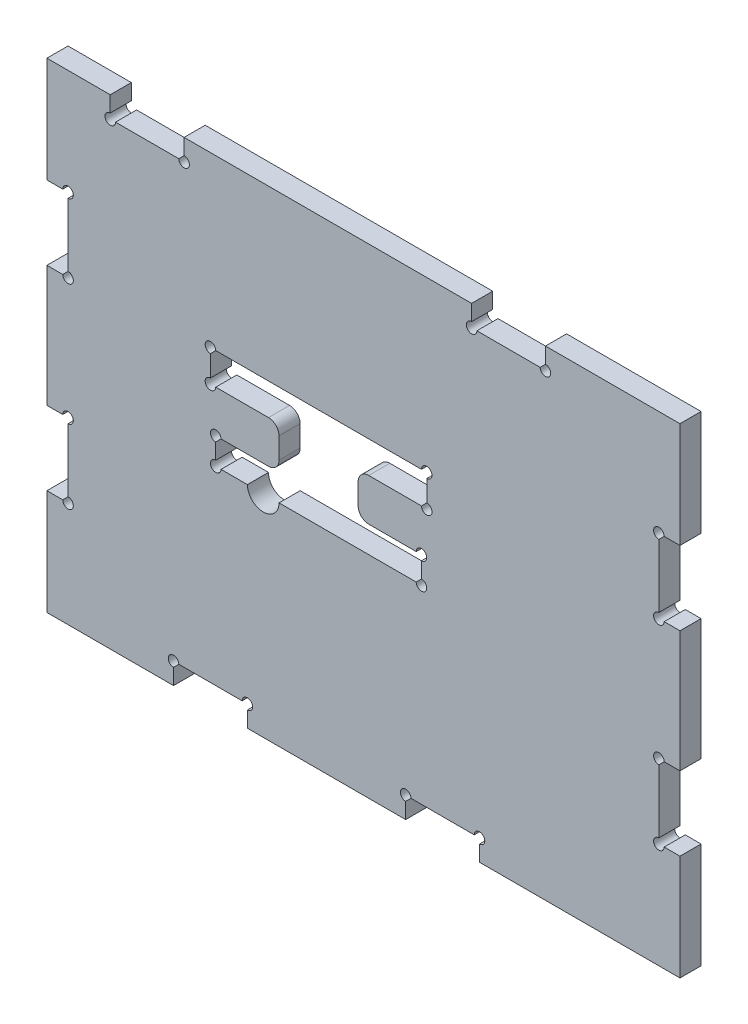
from build123d import *

# Parameters (mm, degrees)
SKETCH_1_W          = 60
SKETCH_1_H          = 45.5
EXTRUDE_1_DEPTH     = 2
SKETCH_2_W          = 7
SKETCH_2_H          = 2
SKETCH_2_W_2        = 2
SKETCH_2_H_2        = 7
CUT_EXTRUDE_1_DEPTH = 76.327617777
SKETCH_4_R          = 0.5
CUT_EXTRUDE_2_DEPTH = 76.327617777
SKETCH_5_W          = 20.5
SKETCH_5_H          = 8
CUT_EXTRUDE_3_DEPTH = 76.327617777
SKETCH_6_W          = 6.5
SKETCH_6_H          = 5
EXTRUDE_2_DEPTH     = 2
SKETCH_7_R          = 0.5
CUT_EXTRUDE_4_DEPTH = 76.327617777
SKETCH_8_W          = 19.5
SKETCH_8_H          = 2.5
CUT_EXTRUDE_5_DEPTH = 76.327617777
FILLET_1_R          = 1
SKETCH_9_R          = 0.5
CUT_EXTRUDE_6_DEPTH = 2
SKETCH_10_R         = 1.5
CUT_EXTRUDE_7_DEPTH = 76.327617777


with BuildPart() as part:
    # 草图1 → 凸台-拉伸1 (new body)
    with BuildSketch(Plane.XY):
        with Locations((30, 22.75)):
            Rectangle(SKETCH_1_W, SKETCH_1_H)
    extrude(amount=EXTRUDE_1_DEPTH)

    # 草图2 → 切除-拉伸1 (cut, through all)
    with BuildSketch(Plane.XY.offset(2)):
        with Locations((9.5, 44.5)):
            Rectangle(SKETCH_2_W, SKETCH_2_H)
        with Locations((43.75, 44.5)):
            Rectangle(SKETCH_2_W, SKETCH_2_H)
        with Locations((15.5, 1)):
            Rectangle(SKETCH_2_W, SKETCH_2_H)
        with Locations((37.5, 1)):
            Rectangle(SKETCH_2_W, SKETCH_2_H)
        with Locations((1, 32)):
            Rectangle(SKETCH_2_W_2, SKETCH_2_H_2)
        with Locations((1, 13.5)):
            Rectangle(SKETCH_2_W_2, SKETCH_2_H_2)
        with Locations((59, 32)):
            Rectangle(SKETCH_2_W_2, SKETCH_2_H_2)
        with Locations((59, 13.5)):
            Rectangle(SKETCH_2_W_2, SKETCH_2_H_2)
    extrude(amount=-CUT_EXTRUDE_1_DEPTH, mode=Mode.SUBTRACT)

    # 草图4 → 切除-拉伸2 (cut, through all)
    with BuildSketch(Plane.XY.offset(2)):
        with Locations((6, 43.5)):
            Circle(SKETCH_4_R)
    cut_extrude_2 = extrude(amount=-CUT_EXTRUDE_2_DEPTH, mode=Mode.SUBTRACT)

    # 草图5 → 切除-拉伸3 (cut, through all)
    with BuildSketch(Plane.XY.offset(2)):
        with Locations((25.75, 25.5)):
            Rectangle(SKETCH_5_W, SKETCH_5_H)
    extrude(amount=-CUT_EXTRUDE_3_DEPTH, mode=Mode.SUBTRACT)

    # 草图6 → 凸台-拉伸2 (add)
    with BuildSketch(Plane.XY.offset(2)):
        with Locations((18.75, 24)):
            Rectangle(SKETCH_6_W, SKETCH_6_H)
        with Locations((32.75, 24)):
            Rectangle(SKETCH_6_W, SKETCH_6_H)
    extrude(amount=-EXTRUDE_2_DEPTH)

    # 草图7 → 切除-拉伸4 (cut, through all)
    with BuildSketch(Plane.XY.offset(2)):
        with Locations((15.5, 29.5)):
            Circle(SKETCH_7_R)
        with Locations((15.5, 26.5)):
            Circle(SKETCH_7_R)
        with Locations((36, 29.5)):
            Circle(SKETCH_7_R)
        with Locations((36, 26.5)):
            Circle(SKETCH_7_R)
    extrude(amount=-CUT_EXTRUDE_4_DEPTH, mode=Mode.SUBTRACT)

    # 草图8 → 切除-拉伸5 (cut, through all)
    with BuildSketch(Plane.XY.offset(2)):
        with Locations((25.75, 21.25)):
            Rectangle(SKETCH_8_W, SKETCH_8_H)
    extrude(amount=-CUT_EXTRUDE_5_DEPTH, mode=Mode.SUBTRACT)

    # 圆角1
    fillet_1_edges = [part.edges().sort_by_distance(p)[0] for p in [
        (22, 26.5, 1),
        (29.5, 26.5, 1),
        (29.5, 22.5, 1),
        (22, 22.5, 1),
    ]]
    fillet(fillet_1_edges, radius=FILLET_1_R)

    # 草图阵列1: 切除-拉伸2 at 15 more places
    with Locations((7, 0, 0), (34.25, 0, 0), (41.25, 0, 0), (6, -41.5, 0), (13, -41.5, 0), (28, -41.5, 0), (35, -41.5, 0), (-4, -8, 0), (-4, -15, 0), (-4, -26.5, 0), (-4, -33.5, 0), (52, -8, 0), (52, -15, 0), (52, -26.5, 0), (52, -33.5, 0)):
        add(cut_extrude_2, mode=Mode.SUBTRACT)

    # 草图9 → 切除-拉伸6 (cut)
    with BuildSketch(Plane.XY.offset(2)):
        with Locations((16, 20)):
            Circle(SKETCH_9_R)
        with Locations((16, 22.5)):
            Circle(SKETCH_9_R)
        with Locations((35.5, 20)):
            Circle(SKETCH_9_R)
        with Locations((35.5, 22.5)):
            Circle(SKETCH_9_R)
    extrude(amount=-CUT_EXTRUDE_6_DEPTH, mode=Mode.SUBTRACT)

    # 草图10 → 切除-拉伸7 (cut, through all)
    with BuildSketch(Plane.XY.offset(2)):
        with Locations((20.5, 20)):
            Circle(SKETCH_10_R)
    extrude(amount=-CUT_EXTRUDE_7_DEPTH, mode=Mode.SUBTRACT)


solid = part.part
